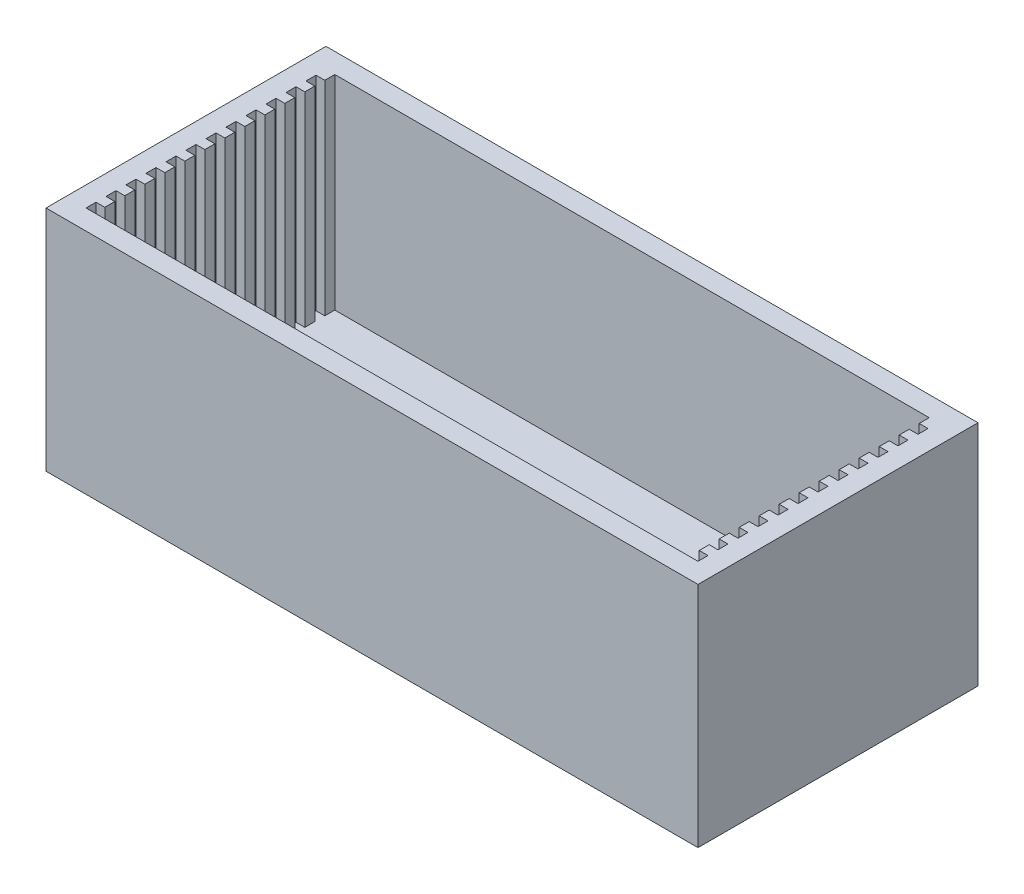
from build123d import *

# Parameters (mm, degrees)
SKETCH1_W           = 81.5
SKETCH1_H           = 35
BOSS_EXTRUDE1_DEPTH = 3
SKETCH2_W           = 81.5
SKETCH2_H           = 35
BOSS_EXTRUDE2_DEPTH = 25.5


with BuildPart() as part:
    # Sketch1 → Boss-Extrude1 (new body)
    with BuildSketch(Plane(origin=(0, 0, 0), x_dir=(1, 0, 0), z_dir=(0, 1, 0))):
        with Locations((40.75, 17.5)):
            Rectangle(SKETCH1_W, SKETCH1_H)
    extrude(amount=BOSS_EXTRUDE1_DEPTH)

    # Sketch2 → Boss-Extrude2 (add)
    with BuildSketch(Plane(origin=(0, 3, 0), x_dir=(1, 0, 0), z_dir=(0, 1, 0))):
        with Locations((40.75, 17.5)):
            Rectangle(SKETCH2_W, SKETCH2_H)
        Polygon((79, 5), (79, 6.25), (77.899410911, 6.25), (77.899410911, 7.5), (79, 7.5), (79, 8.75), (77.899410911, 8.75), (77.899410911, 10), (79, 10), (79, 11.25), (77.899410911, 11.25), (77.899410911, 12.5), (79, 12.5), (79, 13.75), (77.899410911, 13.75), (77.899410911, 15), (79, 15), (79, 16.25), (77.899410911, 16.25), (77.899410911, 17.5), (79, 17.5), (79, 18.75), (77.899410911, 18.75), (77.899410911, 20), (79, 20), (79, 21.25), (77.899410911, 21.25), (77.899410911, 22.5), (79, 22.5), (79, 23.75), (77.899410911, 23.75), (77.899410911, 25), (79, 25), (79, 26.25), (77.899410911, 26.25), (77.899410911, 27.5), (79, 27.5), (79, 28.75), (77.899410911, 28.75), (77.899410911, 30), (79, 30), (79, 31.25), (77.899410911, 31.25), (77.899410911, 32.5), (3.600589089, 32.5), (3.600589089, 31.25), (2.5, 31.25), (2.5, 30), (3.600589089, 30), (3.600589089, 28.75), (2.5, 28.75), (2.5, 27.5), (3.600589089, 27.5), (3.600589089, 26.25), (2.5, 26.25), (2.5, 25), (3.600589089, 25), (3.600589089, 23.75), (2.5, 23.75), (2.5, 22.5), (3.600589089, 22.5), (3.600589089, 21.25), (2.5, 21.25), (2.5, 20), (3.600589089, 20), (3.600589089, 18.75), (2.5, 18.75), (2.5, 17.5), (3.600589089, 17.5), (3.600589089, 16.25), (2.5, 16.25), (2.5, 15), (3.600589089, 15), (3.600589089, 13.75), (2.5, 13.75), (2.5, 12.5), (3.600589089, 12.5), (3.600589089, 11.25), (2.5, 11.25), (2.5, 10), (3.600589089, 10), (3.600589089, 8.75), (2.5, 8.75), (2.5, 7.5), (3.600589089, 7.5), (3.600589089, 6.25), (2.5, 6.25), (2.5, 5), (3.600589089, 5), (3.600589089, 3.75), (2.5, 3.75), (2.5, 2.5), (79, 2.5), (79, 3.75), (77.899410911, 3.75), (77.899410911, 5), align=None, mode=Mode.SUBTRACT)
    extrude(amount=BOSS_EXTRUDE2_DEPTH)


solid = part.part
